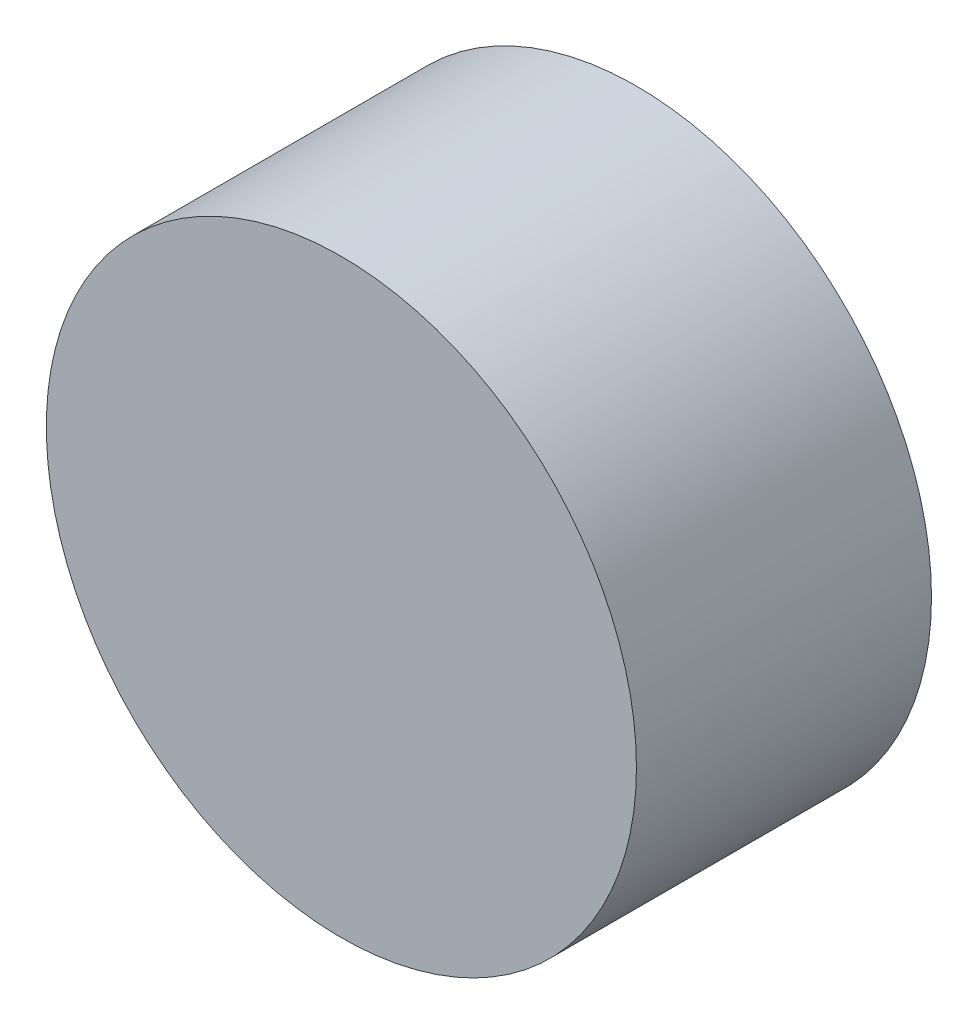
from build123d import *

# Parameters (mm, degrees)
ESQUISSE1_R = 3
MAIN_DEPTH  = 3


with BuildPart() as part:
    # Esquisse1 → Main (new body)
    with BuildSketch(Plane.XY):
        Circle(ESQUISSE1_R)
    extrude(amount=MAIN_DEPTH)


solid = part.part
